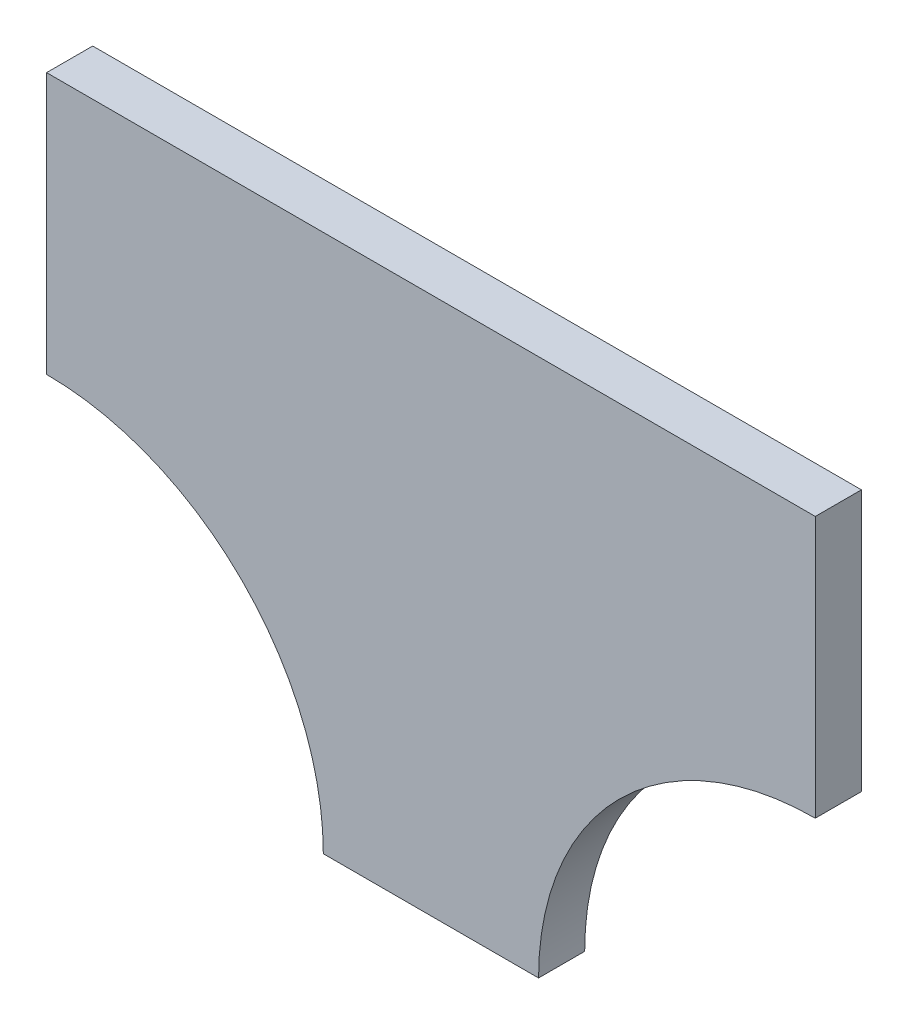
from build123d import *

# Parameters (mm, degrees)
BOSS_EXTRUDE1_DEPTH = 120


with BuildPart() as part:
    # Sketch1 → Boss-Extrude1 (new body)
    with BuildSketch(Plane.XY):
        with BuildLine():
            ThreePointArc((-1000, 20), (-490.883117546, -190.883117546), (-280, -700))
            Line((-280, -700), (280, -700))
            ThreePointArc((280, -700), (490.883117546, -190.883117546), (1000, 20))
            Line((1000, 20), (1000, 700))
            Line((1000, 700), (-1000, 700))
            Line((-1000, 700), (-1000, 20))
        make_face()
    extrude(amount=BOSS_EXTRUDE1_DEPTH)


solid = part.part
